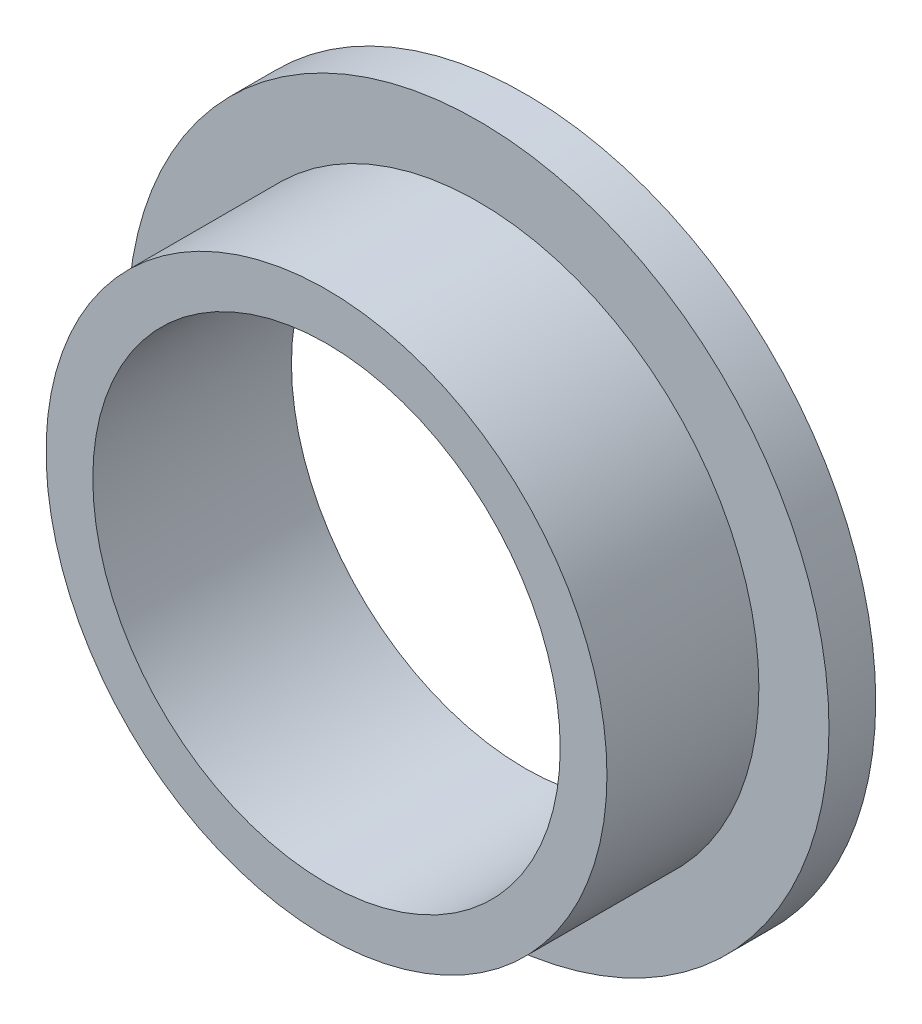
from build123d import *


with BuildPart() as part:
    # Sketch1 → Revolve1 (revolve)
    with BuildSketch(Plane(origin=(0, 0, 0), x_dir=(0, 0, -1), z_dir=(1, 0, 0)), mode=Mode.PRIVATE) as revolve1_sk:
        Polygon((-25.5, 30), (0, 30), (0, 45), (-6, 45), (-6, 36), (-25.5, 36), align=None)
    revolve(revolve1_sk.sketch.rotate(Axis((0, 0, 30.762711864), (0, 0, -1)), 90), axis=Axis((0, 0, 30.762711864), (0, 0, -1)))


solid = part.part
